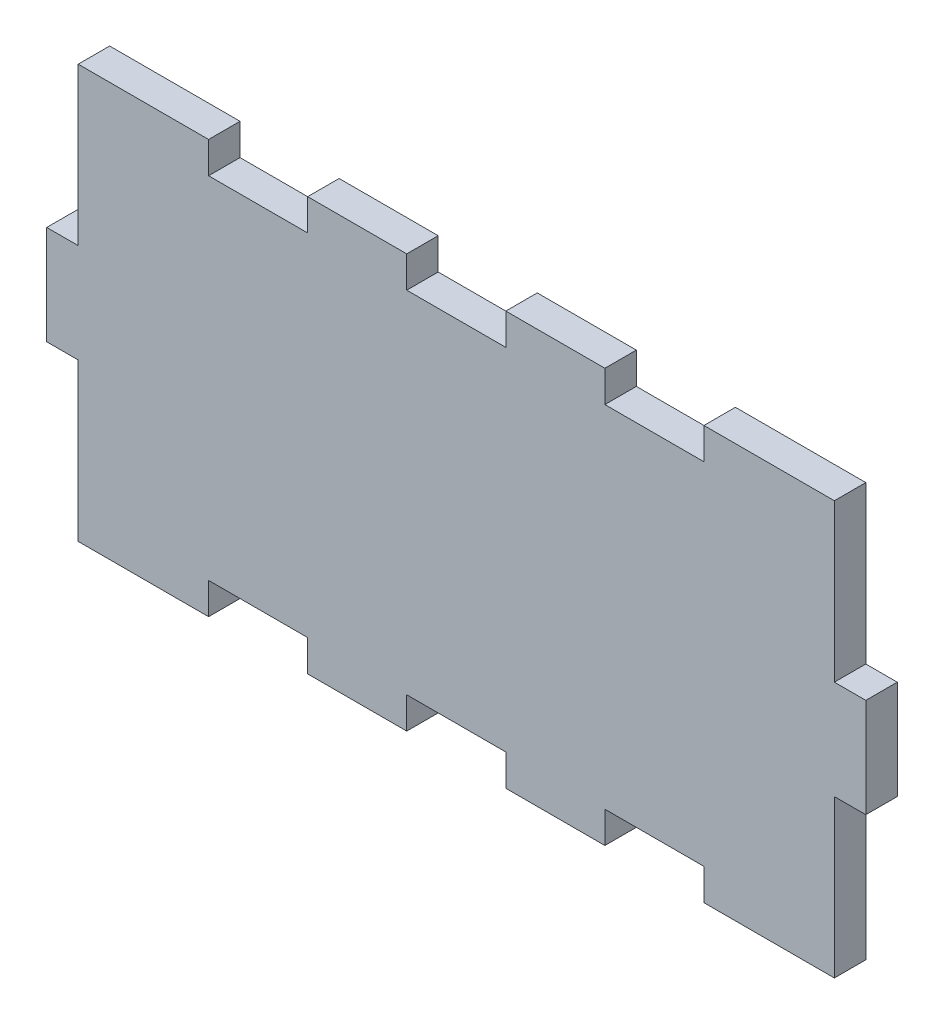
from build123d import *

# Parameters (mm, degrees)
ESQUISSE1_W             = 165.35
ESQUISSE1_H             = 83.439
BOSS_EXTRU_1_DEPTH      = 6.35
ESQUISSE2_W             = 6.35
ESQUISSE2_H             = 31.7195
ENL_V_MAT_EXTRU_1_DEPTH = 93.822383105
ESQUISSE3_W             = 20
ESQUISSE3_H             = 6.35
ENL_V_MAT_EXTRU_2_DEPTH = 93.822383105


with BuildPart() as part:
    # Esquisse1 → Boss.-Extru.1 (new body)
    with BuildSketch(Plane.XY):
        Rectangle(ESQUISSE1_W, ESQUISSE1_H)
    extrude(amount=BOSS_EXTRU_1_DEPTH)

    # Esquisse2 → Enlèv. mat.-Extru.1 (cut, through all)
    with BuildSketch(Plane.XY.offset(6.35)):
        with Locations((-79.5, -25.85975)):
            Rectangle(ESQUISSE2_W, ESQUISSE2_H)
        with Locations((-79.5, 25.85975)):
            Rectangle(ESQUISSE2_W, ESQUISSE2_H)
    enl_v_mat_extru_1 = extrude(amount=-ENL_V_MAT_EXTRU_1_DEPTH, mode=Mode.SUBTRACT)

    # Symétrie1: Enlèv. mat.-Extru.1 across plane
    add(enl_v_mat_extru_1.mirror(Plane(origin=(0, 0, 0), x_dir=(0, 0, 1), z_dir=(1, 0, 0))), mode=Mode.SUBTRACT)

    # Esquisse3 → Enlèv. mat.-Extru.2 (cut, through all)
    with BuildSketch(Plane.XY.offset(6.35)):
        with Locations((0, -38.5445)):
            Rectangle(ESQUISSE3_W, ESQUISSE3_H)
        with Locations((40, -38.5445)):
            Rectangle(ESQUISSE3_W, ESQUISSE3_H)
        with Locations((-40, -38.5445)):
            Rectangle(ESQUISSE3_W, ESQUISSE3_H)
    enl_v_mat_extru_2 = extrude(amount=-ENL_V_MAT_EXTRU_2_DEPTH, mode=Mode.SUBTRACT)

    # Symétrie2: Enlèv. mat.-Extru.2 across plane
    add(enl_v_mat_extru_2.mirror(Plane.ZX), mode=Mode.SUBTRACT)


solid = part.part
